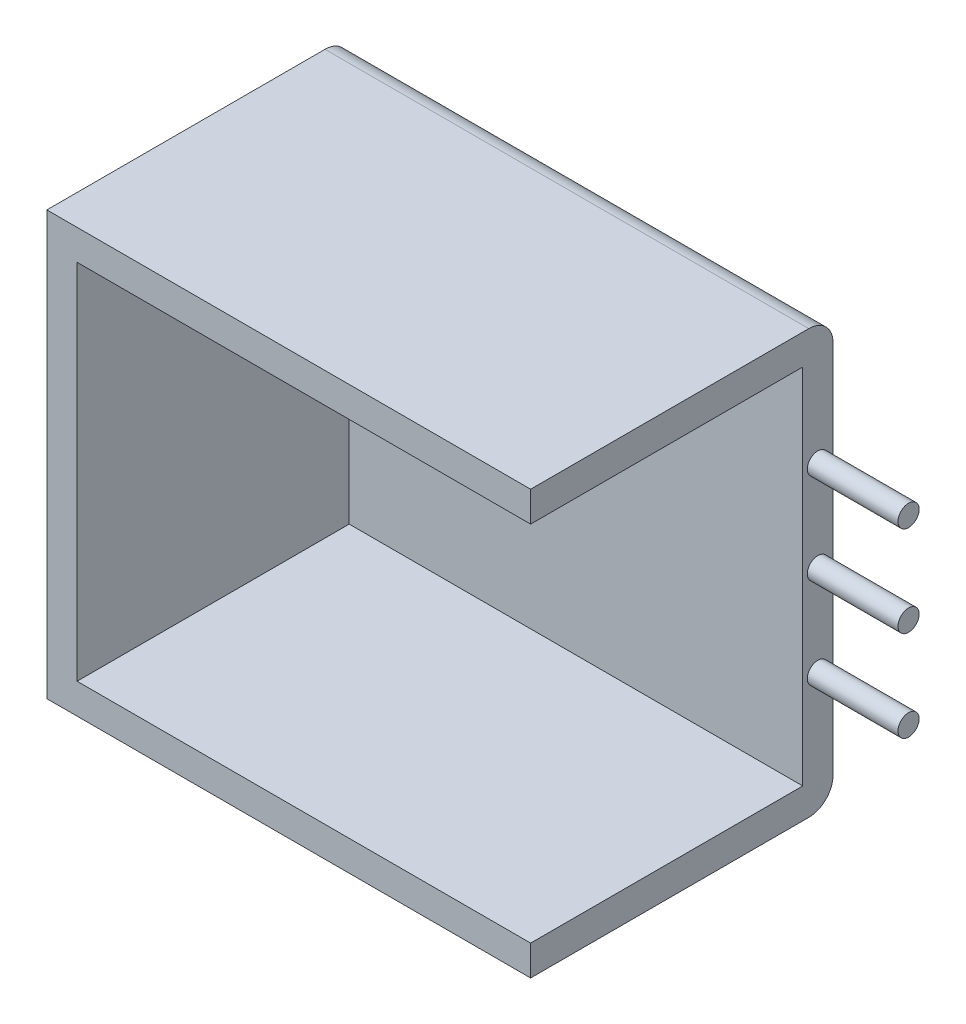
from build123d import *

# Parameters (mm, degrees)
SKETCH1_W               = 150
SKETCH1_H               = 120
BOSS_EXTRUDE1_DEPTH     = 10
SKETCH2_R               = 3.5
BOSS_EXTRUDE2_DEPTH     = 30
CROQUIS2_W              = 100
CROQUIS2_H              = 120
SALIENTE_EXTRUIR1_DEPTH = 10
CROQUIS3_W              = 160
CROQUIS3_H              = 100
SALIENTE_EXTRUIR2_DEPTH = 10
CROQUIS4_W              = 160
CROQUIS4_H              = 100
SALIENTE_EXTRUIR3_DEPTH = 10
FILLET1_R               = 8


with BuildPart() as part:
    # Sketch1 → Boss-Extrude1 (new body)
    with BuildSketch(Plane.XY):
        with Locations((-75, 0)):
            Rectangle(SKETCH1_W, SKETCH1_H)
    extrude(amount=BOSS_EXTRUDE1_DEPTH)

    # Sketch2 → Boss-Extrude2 (add)
    with BuildSketch(Plane(origin=(0, 0, 0), x_dir=(0, 0, -1), z_dir=(1, 0, 0))):
        with Locations(Location((-5, 30, 0), (0, 0, 180))):
            Circle(SKETCH2_R)
        with Locations(Location((-5, -30, 0), (0, 0, 180))):
            Circle(SKETCH2_R)
        with Locations(Location((-5, 0, 0), (0, 0, 180))):
            Circle(SKETCH2_R)
    extrude(amount=BOSS_EXTRUDE2_DEPTH)

    # Croquis2 → Saliente-Extruir1 (add)
    with BuildSketch(Plane.ZY.offset(150)):
        with Locations((50, 0)):
            Rectangle(CROQUIS2_W, CROQUIS2_H)
    extrude(amount=SALIENTE_EXTRUIR1_DEPTH)

    # Croquis3 → Saliente-Extruir2 (add)
    with BuildSketch(Plane.XZ.offset(60)):
        with Locations((-80, 50)):
            Rectangle(CROQUIS3_W, CROQUIS3_H)
    extrude(amount=SALIENTE_EXTRUIR2_DEPTH)

    # Croquis4 → Saliente-Extruir3 (add)
    with BuildSketch(Plane(origin=(0, 60, 0), x_dir=(1, 0, 0), z_dir=(0, 1, 0))):
        with Locations((-80, -50)):
            Rectangle(CROQUIS4_W, CROQUIS4_H)
    extrude(amount=SALIENTE_EXTRUIR3_DEPTH)

    # Fillet1
    fillet1_edges = [part.edges().sort_by_distance(p)[0] for p in [
        (-80, -70, 0),
        (-80, 70, 0),
    ]]
    fillet(fillet1_edges, radius=FILLET1_R)


solid = part.part
